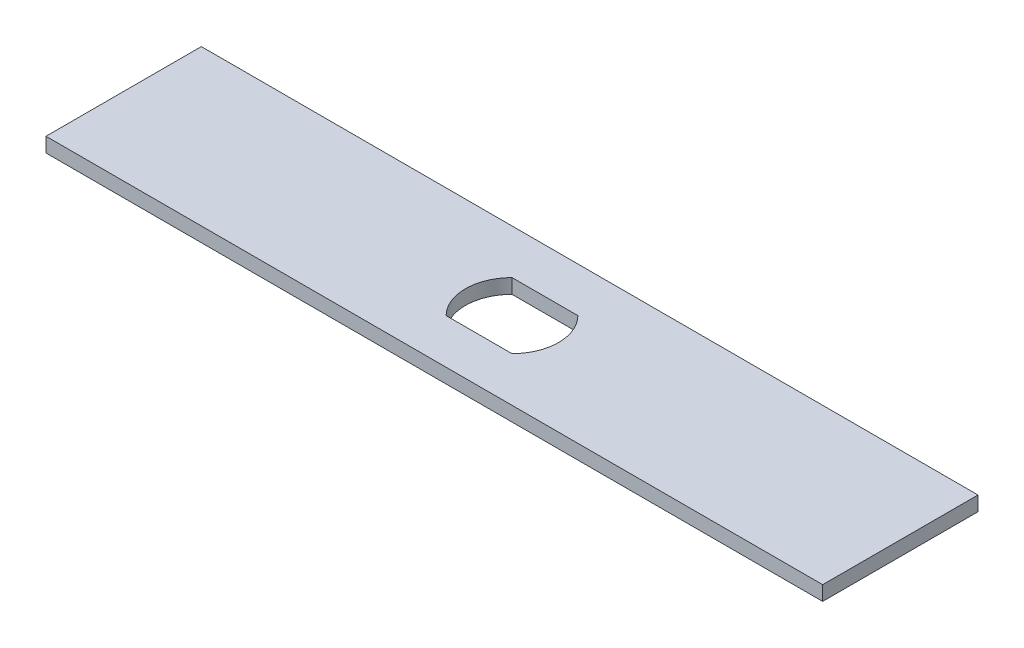
from build123d import *

# Parameters (mm, degrees)
SKETCH1_W           = 254
SKETCH1_H           = 50.8
SKETCH1_R           = 15.24
BOSS_EXTRUDE1_DEPTH = 4.7498


with BuildPart() as part:
    # Sketch1 → Boss-Extrude1 (new body)
    # profile 1 of 3: a face of its own
    with BuildSketch(Plane(origin=(0, 0, 0), x_dir=(1, 0, 0), z_dir=(0, 1, 0))):
        with Locations((127, -25.4)):
            Rectangle(SKETCH1_W, SKETCH1_H)
        with Locations((127, -25.4)):
            Circle(SKETCH1_R, mode=Mode.SUBTRACT)
    # profile 2 of 3: a face of its own
    with BuildSketch(Plane(origin=(0, 0, 0), x_dir=(1, 0, 0), z_dir=(0, 1, 0))):
        with BuildLine():
            ThreePointArc((137.776307345, -14.623692655), (127, -10.16), (116.223692655, -14.623692655))
            Line((116.223692655, -14.623692655), (137.776307345, -14.623692655))
        make_face()
    # profile 3 of 3: a face of its own
    with BuildSketch(Plane(origin=(0, 0, 0), x_dir=(1, 0, 0), z_dir=(0, 1, 0))):
        with BuildLine():
            ThreePointArc((116.223692655, -36.176307345), (127, -40.64), (137.776307345, -36.176307345))
            Line((137.776307345, -36.176307345), (116.223692655, -36.176307345))
        make_face()
    extrude(amount=BOSS_EXTRUDE1_DEPTH)


solid = part.part
